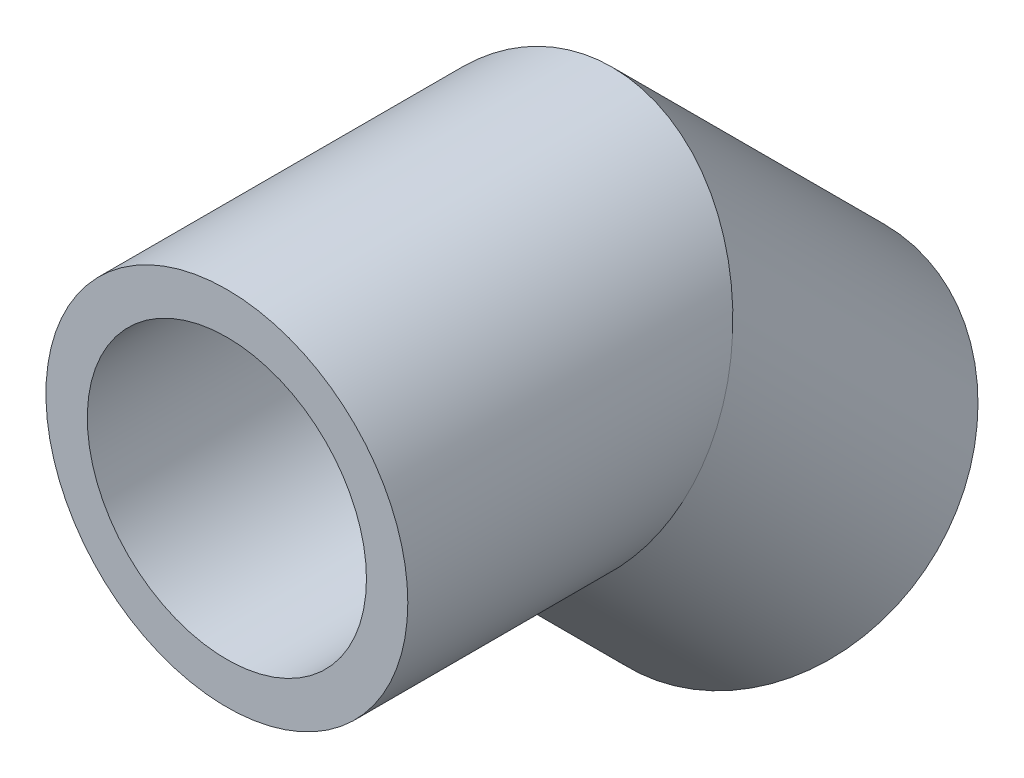
from build123d import *

# Parameters (mm, degrees)
SKETCH1_R   = 17.5
SKETCH1_R_2 = 13.5


with BuildPart() as part:
    # Sweep1: sweep along a curve in space
    with BuildLine() as sweep1_path:
        Line((0, 0, 0), (0, 0, -30))
        Line((0, 0, -30), (0, -21.213203436, -51.213203436))
    # Sketch1 → Sweep1 (sweep)
    with BuildSketch(Plane.XY):
        Circle(SKETCH1_R)
        Circle(SKETCH1_R_2, mode=Mode.SUBTRACT)
    sweep(path=sweep1_path.line, transition=Transition.RIGHT)


solid = part.part
